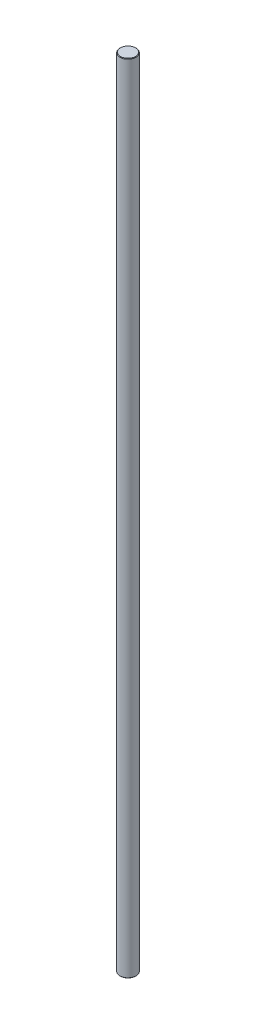
from build123d import *

# Parameters (mm, degrees)
SZKIC1_R                    = 4
DODANIE_WYCI_GNI_CIE1_DEPTH = 398
SFAZOWANIE1_SIZE            = 0.25


with BuildPart() as part:
    # Szkic1 → Dodanie-wyciągnięcie1 (new body)
    with BuildSketch(Plane(origin=(0, 0, 0), x_dir=(1, 0, 0), z_dir=(0, 1, 0))):
        with Locations(Location((-19.421806723, 6.007592757, 0), (0, 0, 270))):
            Circle(SZKIC1_R)
    extrude(amount=DODANIE_WYCI_GNI_CIE1_DEPTH)

    # Sfazowanie1
    sfazowanie1_edges = [part.edges().sort_by_distance(p)[0] for p in [
        (-19.421806723, 0, -10.007592757),
        (-19.421806723, 398, -10.007592757),
    ]]
    chamfer(sfazowanie1_edges, length=SFAZOWANIE1_SIZE)


solid = part.part
